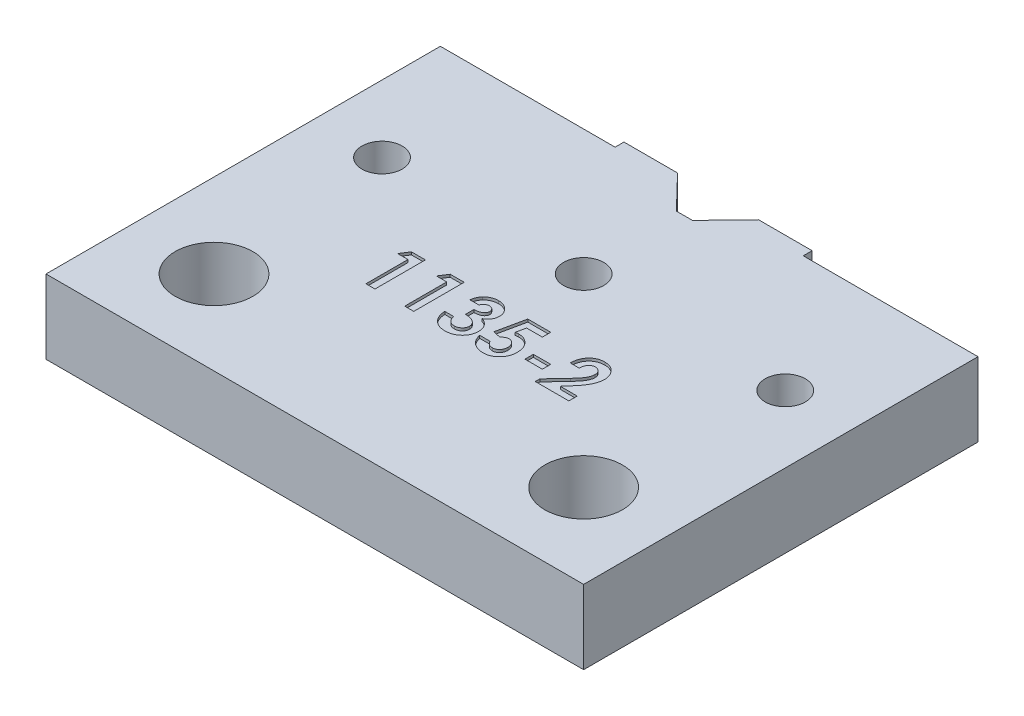
from build123d import *

# Parameters (mm, degrees)
CROQUIS1_W               = 50.8
CROQUIS1_H               = 38.1
SALIENTE_EXTRUIR1_DEPTH  = 6.985
CROQUIS2_W               = 16.51
CROQUIS2_H               = 0.8382
CORTAR_EXTRUIR1_DEPTH    = 64.883019849
TALADRO_ROSCADO_10_241_D = 3.7973
CROQUIS5_R               = 3.6703
CORTAR_EXTRUIR2_DEPTH    = 64.883019849
CROQUIS6_W               = 1.648557693
CROQUIS6_H               = 0.79375
CORTAR_EXTRUIR3_DEPTH    = 0.254


with BuildPart() as part:
    # Croquis1 → Saliente-Extruir1 (new body)
    with BuildSketch(Plane(origin=(0, 0, 0), x_dir=(1, 0, 0), z_dir=(0, 1, 0))):
        with Locations((25.4, -19.05)):
            Rectangle(CROQUIS1_W, CROQUIS1_H)
    extrude(amount=SALIENTE_EXTRUIR1_DEPTH)

    # Croquis2 → Cortar-Extruir1 (cut, through all)
    with BuildSketch(Plane(origin=(0, 6.985, 0), x_dir=(1, 0, 0), z_dir=(0, 1, 0))):
        Polygon((21.57193814, 0), (24.638, -3.175), (26.162, -3.175), (29.22806186, 0), align=None)
        with Locations((8.255, -0.4191)):
            Rectangle(CROQUIS2_W, CROQUIS2_H)
        with Locations((42.545, -0.4191)):
            Rectangle(CROQUIS2_W, CROQUIS2_H)
    extrude(amount=-CORTAR_EXTRUIR1_DEPTH, mode=Mode.SUBTRACT)

    # Taladro roscado #10-241 (through all)
    with Locations(Plane(origin=(0, 6.985, 0), x_dir=(1, 0, 0), z_dir=(0, 1, 0))):
        with Locations((6.35, -12.7), (44.45, -12.7), (25.4, -12.7)):
            Hole(TALADRO_ROSCADO_10_241_D / 2)

    # Croquis5 → Cortar-Extruir2 (cut, through all)
    with BuildSketch(Plane(origin=(0, 6.985, 0), x_dir=(1, 0, 0), z_dir=(0, 1, 0))):
        with Locations(Location((7.9375, -30.1625, 0), (0, 0, 270))):
            Circle(CROQUIS5_R)
        with Locations(Location((42.8625, -30.1625, 0), (0, 0, 270))):
            Circle(CROQUIS5_R)
    extrude(amount=-CORTAR_EXTRUIR2_DEPTH, mode=Mode.SUBTRACT)

    # Croquis6 → Cortar-Extruir3 (cut)
    with BuildSketch(Plane(origin=(0, 6.985, 0), x_dir=(1, 0, 0), z_dir=(0, 1, 0))):
        with BuildLine():
            Line((32.892109266, -20.612303363), (32.037301574, -20.612303363))
            add(Edge.make_bspline(
                [(32.037301574, -20.612303363), (32.040993357, -20.547641684), (32.04820688, -20.421296644), (32.076900451, -20.237776428), (32.115348852, -20.064370005), (32.166663346, -19.901683969), (32.231143367, -19.749777435), (32.307129675, -19.608132545), (32.39656355, -19.477495063), (32.497541543, -19.358494997), (32.608349327, -19.251738939), (32.726686423, -19.157082312), (32.854362957, -19.078974045), (32.989046173, -19.014698173), (33.130713138, -18.963344738), (33.280704244, -18.929010811), (33.437720786, -18.905759539), (33.545211325, -18.903724959), (33.599996886, -18.902687979)],
                knots=[0, 0, 0, 0, 1.199038563, 2.342849363, 3.436047546, 4.486744587, 5.497670872, 6.488682221, 7.459191391, 8.424610317, 9.374430501, 10.305433194, 11.225809216, 12.140057399, 13.06607119, 14.010487599, 14.985989317, 16, 16, 16, 16], degree=3))
            add(Edge.make_bspline(
                [(33.599996886, -18.902687979), (33.667245386, -18.904786309), (33.798530217, -18.908882742), (33.989297489, -18.943826674), (34.167453264, -19.002275799), (34.332868038, -19.083944641), (34.484133607, -19.187696345), (34.621224887, -19.311403271), (34.739996018, -19.457660856), (34.841200045, -19.62038356), (34.925288496, -19.792684003), (34.98421418, -19.970849806), (35.022945397, -20.150153171), (35.027076321, -20.270886981), (35.029128497, -20.330865563)],
                knots=[0, 0, 0, 0, 1.075374347, 2.099382735, 3.09057751, 4.06680945, 5.040638231, 6.016817125, 7.011024321, 8.044445721, 9.0776792, 10.070479129, 11.0414456, 12, 12, 12, 12], degree=3))
            add(Edge.make_bspline(
                [(35.029128497, -20.330865563), (35.028329488, -20.367144848), (35.026721281, -20.440166088), (35.015539202, -20.550665146), (34.998763874, -20.663221355), (34.973470768, -20.77773821), (34.94192819, -20.89424781), (34.903662485, -21.01309883), (34.857786041, -21.133617427), (34.805064443, -21.257160018), (34.742167443, -21.384127696), (34.668932629, -21.516423758), (34.583416183, -21.653930846), (34.486651037, -21.797425369), (34.378167224, -21.946681015), (34.257435163, -22.101248179), (34.125845404, -22.261671507), (34.03245245, -22.368905499), (33.984469543, -22.423999577)],
                knots=[0, 0, 0, 0, 0.728284026, 1.46585585, 2.227944881, 3.01186502, 3.81876927, 4.650621989, 5.517437689, 6.406905708, 7.346299482, 8.360816762, 9.441613733, 10.596154504, 11.834900912, 13.145207542, 14.533280747, 16, 16, 16, 16], degree=3))
            Line((33.984469543, -22.423999577), (33.487421766, -22.993553363))
            Line((33.487421766, -22.993553363), (35.090186189, -22.993553363))
            Line((35.090186189, -22.993553363), (35.090186189, -23.787303363))
            Line((35.090186189, -23.787303363), (31.915186189, -23.787303363))
            Line((31.915186189, -23.787303363), (31.915186189, -23.354175359))
            Line((31.915186189, -23.354175359), (33.325237271, -21.853491765))
            add(Edge.make_bspline(
                [(33.325237271, -21.853491765), (33.366061873, -21.809716358), (33.445127021, -21.724936378), (33.557628579, -21.600427957), (33.65943255, -21.482272438), (33.748427948, -21.369211702), (33.829285136, -21.26491298), (33.898398698, -21.166232578), (33.956400969, -21.074062602), (34.019370661, -20.962921709), (34.079171169, -20.830366416), (34.134041755, -20.677657284), (34.167489174, -20.531702523), (34.172105975, -20.436595263), (34.174320805, -20.390969229)],
                knots=[0, 0, 0, 0, 1.246127091, 2.413378631, 3.493388633, 4.492180848, 5.408488754, 6.240484944, 6.999099869, 7.674939598, 8.898438119, 10.020720584, 11.050475521, 12, 12, 12, 12], degree=3))
            add(Edge.make_bspline(
                [(34.174320805, -20.390969229), (34.17266483, -20.34682956), (34.169456114, -20.261301876), (34.134194927, -20.1396392), (34.079567073, -20.029486067), (34.002588712, -19.934133976), (33.909343807, -19.85577684), (33.80159056, -19.797497004), (33.680207478, -19.763869806), (33.595115625, -19.759660882), (33.551341538, -19.757495671)],
                knots=[0, 0, 0, 0, 1.062038974, 2.057870785, 3.028805853, 4.01125022, 4.991535629, 5.949134679, 6.94496649, 8, 8, 8, 8], degree=3))
            add(Edge.make_bspline(
                [(33.551341538, -19.757495671), (33.528727287, -19.758295526), (33.484207502, -19.759870169), (33.418766899, -19.770352139), (33.356495463, -19.788825517), (33.296700079, -19.813577243), (33.2400189, -19.846385834), (33.186594892, -19.886827649), (33.135865167, -19.933874971), (33.088062391, -19.987380688), (33.044555624, -20.047093083), (33.005913073, -20.112466807), (32.973962117, -20.18346128), (32.945831333, -20.259139266), (32.924135527, -20.340313609), (32.908338289, -20.426498489), (32.896328703, -20.517553694), (32.893541332, -20.580145586), (32.892109266, -20.612303363)],
                knots=[0, 0, 0, 0, 0.903469896, 1.778625579, 2.63899355, 3.493148037, 4.358286772, 5.247621495, 6.164656832, 7.118446693, 8.109501108, 9.111810964, 10.146451449, 11.215617525, 12.33435995, 13.498009769, 14.714554818, 16, 16, 16, 16], degree=3))
        make_face()
        with Locations((30.419272728, -22.047159133)):
            Rectangle(CROQUIS6_W, CROQUIS6_H)
        with BuildLine():
            Line((26.449568701, -19.024803363), (28.618070805, -19.024803363))
            Line((28.618070805, -19.024803363), (28.618070805, -19.818553363))
            Line((28.618070805, -19.818553363), (27.126927475, -19.818553363))
            Line((27.126927475, -19.818553363), (26.940892319, -20.719154325))
            add(Edge.make_bspline(
                [(26.940892319, -20.719154325), (26.966242272, -20.712094043), (27.016237588, -20.698169716), (27.091555593, -20.684205379), (27.164549237, -20.675154139), (27.21244722, -20.673946824), (27.23568649, -20.673361056)],
                knots=[0, 0, 0, 0, 1.05461699, 2.079921384, 3.068411212, 4, 4, 4, 4], degree=3))
            add(Edge.make_bspline(
                [(27.23568649, -20.673361056), (27.286327292, -20.67452146), (27.38615147, -20.676808874), (27.532181574, -20.698523886), (27.672014026, -20.732724372), (27.805220922, -20.781501321), (27.931672137, -20.844985781), (28.051520956, -20.921784181), (28.164914471, -21.012031407), (28.269838338, -21.115783962), (28.366246769, -21.229706617), (28.450068402, -21.352926022), (28.521657307, -21.483685189), (28.578596647, -21.622796914), (28.623538028, -21.769387482), (28.656013674, -21.923550832), (28.675218146, -22.085469672), (28.677807751, -22.195935319), (28.679128497, -22.252274818)],
                knots=[0, 0, 0, 0, 1.01440847, 1.999622559, 2.951875003, 3.895578053, 4.836219714, 5.782137149, 6.743708247, 7.735272588, 8.734977101, 9.730283169, 10.717124674, 11.717316708, 12.737475749, 13.78628267, 14.87096371, 16, 16, 16, 16], degree=3))
            add(Edge.make_bspline(
                [(28.679128497, -22.252274818), (28.677514524, -22.3092539), (28.674329684, -22.421690286), (28.65355152, -22.587011544), (28.616877687, -22.745351988), (28.566502508, -22.897135491), (28.500136435, -23.04124648), (28.420322149, -23.179177838), (28.325710205, -23.309905744), (28.217229072, -23.432090079), (28.09929585, -23.543768907), (27.973724808, -23.642012986), (27.84139812, -23.724684582), (27.702312593, -23.791497209), (27.557266205, -23.84435817), (27.406214933, -23.882838426), (27.248424688, -23.904904715), (27.141305612, -23.907897536), (27.086858365, -23.909418748)],
                knots=[0, 0, 0, 0, 1.06808661, 2.107647099, 3.116961351, 4.110378221, 5.100014249, 6.085620622, 7.093190682, 8.119403071, 9.144090782, 10.133780668, 11.103064255, 12.062861538, 13.020824475, 13.992378307, 14.979551724, 16, 16, 16, 16], degree=3))
            add(Edge.make_bspline(
                [(27.086858365, -23.909418748), (27.038167812, -23.908174302), (26.942139852, -23.905719993), (26.800694882, -23.890634519), (26.664326225, -23.86396326), (26.533757848, -23.825363042), (26.407615953, -23.777854986), (26.287358778, -23.718437184), (26.172325487, -23.64824103), (26.062842733, -23.568547607), (25.960689455, -23.478776056), (25.867454766, -23.380505627), (25.782574214, -23.27497497), (25.707864107, -23.160882157), (25.643558641, -23.038395754), (25.586531242, -22.908959292), (25.539853744, -22.771221042), (25.516166259, -22.675733233), (25.504128497, -22.62720721)],
                knots=[0, 0, 0, 0, 1.054957082, 2.080596141, 3.077793124, 4.061112343, 5.027190972, 5.994718051, 6.962465889, 7.943658696, 8.924948258, 9.904494768, 10.875059, 11.855380583, 12.854004648, 13.869083016, 14.917087635, 16, 16, 16, 16], degree=3))
            Line((25.504128497, -22.62720721), (26.481051574, -22.62720721))
            add(Edge.make_bspline(
                [(26.481051574, -22.62720721), (26.498909751, -22.660833768), (26.533615081, -22.726183147), (26.599632291, -22.812944266), (26.673534366, -22.886930422), (26.75465467, -22.948864474), (26.843518812, -22.995264411), (26.936505745, -23.030451978), (27.034783625, -23.050785569), (27.101715201, -23.053327469), (27.135513713, -23.054611056)],
                knots=[0, 0, 0, 0, 1.104910296, 2.147267069, 3.153527244, 4.136738762, 5.099945312, 6.05603338, 7.018353, 8, 8, 8, 8], degree=3))
            add(Edge.make_bspline(
                [(27.135513713, -23.054611056), (27.159070823, -23.053724728), (27.205419834, -23.051980864), (27.273707772, -23.042755383), (27.338891609, -23.025282533), (27.401455971, -23.001086696), (27.461568922, -22.970911756), (27.518368722, -22.932817859), (27.572843586, -22.888970371), (27.624164184, -22.838655231), (27.670645853, -22.782565553), (27.711405193, -22.722293371), (27.747849664, -22.659177945), (27.77484464, -22.590719114), (27.796951243, -22.518961084), (27.81323144, -22.443362563), (27.822960693, -22.363835256), (27.823861362, -22.309544193), (27.824320805, -22.281849637)],
                knots=[0, 0, 0, 0, 0.978869489, 1.925942215, 2.855067702, 3.774946051, 4.70828698, 5.642468714, 6.60995405, 7.609372294, 8.622401667, 9.629904756, 10.629323, 11.642352373, 12.678539694, 13.745912462, 14.850161547, 16, 16, 16, 16], degree=3))
            add(Edge.make_bspline(
                [(27.824320805, -22.281849637), (27.823787568, -22.254797936), (27.822749612, -22.202141141), (27.814163424, -22.124822106), (27.798802901, -22.051460334), (27.777874056, -21.98149393), (27.751082636, -21.915347763), (27.71834173, -21.852628099), (27.679511465, -21.793651963), (27.63438337, -21.739620052), (27.586259233, -21.690060446), (27.534558447, -21.64671601), (27.479746808, -21.610743137), (27.42352752, -21.579337773), (27.363656512, -21.556481633), (27.301480041, -21.540741453), (27.237063495, -21.529191942), (27.193126367, -21.528513366), (27.170812692, -21.528168748)],
                knots=[0, 0, 0, 0, 1.166249705, 2.270133367, 3.348514167, 4.393962215, 5.415026464, 6.420877785, 7.440098956, 8.453121383, 9.451844239, 10.415694839, 11.355045125, 12.27538808, 13.187007209, 14.108269027, 15.039275622, 16, 16, 16, 16], degree=3))
            add(Edge.make_bspline(
                [(27.170812692, -21.528168748), (27.146574854, -21.529088439), (27.097997029, -21.530931698), (27.025822539, -21.545929801), (26.954518273, -21.570202357), (26.883687705, -21.603690196), (26.814033952, -21.64751521), (26.743718817, -21.698916928), (26.675095898, -21.76163017), (26.631463538, -21.808339136), (26.608891117, -21.832503183)],
                knots=[0, 0, 0, 0, 0.88288272, 1.769486374, 2.674910571, 3.623812639, 4.617874466, 5.670434592, 6.794841017, 8, 8, 8, 8], degree=3))
            Line((26.608891117, -21.832503183), (25.88955518, -21.667456609))
            Line((25.88955518, -21.667456609), (26.449568701, -19.024803363))
        make_face()
        with BuildLine():
            Line((23.000763112, -20.184899517), (22.14595542, -20.184899517))
            add(Edge.make_bspline(
                [(22.14595542, -20.184899517), (22.151990687, -20.14217073), (22.163822429, -20.058403774), (22.192134205, -19.937130088), (22.225998145, -19.822093697), (22.268275543, -19.713658899), (22.317860053, -19.611632534), (22.374247456, -19.515664498), (22.438047321, -19.426166703), (22.486950593, -19.372252877), (22.511347547, -19.345356248)],
                knots=[0, 0, 0, 0, 1.111473889, 2.178970933, 3.205615836, 4.199322666, 5.174200091, 6.12565194, 7.064921805, 8, 8, 8, 8], degree=3))
            add(Edge.make_bspline(
                [(22.511347547, -19.345356248), (22.546536921, -19.309868096), (22.615891478, -19.239924677), (22.731791076, -19.150334883), (22.85327526, -19.072801009), (22.982780447, -19.011331593), (23.118291438, -18.961579222), (23.260885865, -18.928160442), (23.409981035, -18.905986786), (23.511719732, -18.903802604), (23.563638713, -18.902687979)],
                knots=[0, 0, 0, 0, 1.01925491, 2.00884431, 2.983262333, 3.955970413, 4.92937149, 5.924503185, 6.940838805, 8, 8, 8, 8], degree=3))
            add(Edge.make_bspline(
                [(23.563638713, -18.902687979), (23.609797359, -18.903777694), (23.700535955, -18.905919854), (23.833898859, -18.923115956), (23.961049228, -18.953276003), (24.083331078, -18.992709588), (24.198946041, -19.046365571), (24.310445851, -19.108648747), (24.4147152, -19.18504165), (24.511998059, -19.271357943), (24.601370918, -19.364717464), (24.678768206, -19.464511114), (24.745308044, -19.568073174), (24.800128069, -19.67626405), (24.842277218, -19.789266814), (24.871529978, -19.906428663), (24.89067662, -20.027491072), (24.892584125, -20.109775561), (24.893551574, -20.151508592)],
                knots=[0, 0, 0, 0, 1.091422571, 2.145516843, 3.172569842, 4.178562979, 5.178154469, 6.181868002, 7.194278174, 8.227918432, 9.254613415, 10.245994977, 11.209837596, 12.161663635, 13.10878368, 14.055455738, 15.013766427, 16, 16, 16, 16], degree=3))
            add(Edge.make_bspline(
                [(24.893551574, -20.151508592), (24.891566312, -20.203191475), (24.887657941, -20.304939183), (24.855586933, -20.453854512), (24.805387083, -20.596244142), (24.732868517, -20.730115828), (24.642201839, -20.855105245), (24.530956863, -20.967033623), (24.402302132, -21.067655846), (24.305719313, -21.121730242), (24.25626191, -21.14942025)],
                knots=[0, 0, 0, 0, 0.992805628, 1.954529043, 2.915727527, 3.886831945, 4.871318353, 5.87440735, 6.911542536, 8, 8, 8, 8], degree=3))
            add(Edge.make_bspline(
                [(24.25626191, -21.14942025), (24.290208713, -21.1605657), (24.356912657, -21.18246601), (24.451724292, -21.225598421), (24.541879324, -21.272734997), (24.625825315, -21.327495273), (24.704397209, -21.387664986), (24.777116022, -21.453758488), (24.844416232, -21.525631664), (24.905199192, -21.603679791), (24.959146443, -21.68665464), (25.007550439, -21.772639541), (25.047389626, -21.86293847), (25.081138377, -21.956520154), (25.106832755, -22.054225654), (25.124923893, -22.155676371), (25.135381015, -22.260640888), (25.136975904, -22.331754285), (25.137782343, -22.367712017)],
                knots=[0, 0, 0, 0, 1.059543567, 2.081955587, 3.086750234, 4.076226789, 5.052108497, 6.020845489, 6.989030705, 7.970690546, 8.952259656, 9.923888338, 10.895517021, 11.877585046, 12.873342345, 13.889638361, 14.932918083, 16, 16, 16, 16], degree=3))
            add(Edge.make_bspline(
                [(25.137782343, -22.367712017), (25.136147583, -22.420555285), (25.132924169, -22.524751447), (25.112431214, -22.67822173), (25.074277023, -22.82454201), (25.024083072, -22.965395923), (24.957129788, -23.098965095), (24.87833703, -23.228314756), (24.781484898, -23.348959097), (24.673850384, -23.464087641), (24.554315982, -23.568757358), (24.424721243, -23.659501293), (24.287915845, -23.737375734), (24.143034259, -23.800596424), (23.990126821, -23.849283586), (23.829534347, -23.884476911), (23.660582071, -23.906008769), (23.545258925, -23.908265976), (23.486362571, -23.909418748)],
                knots=[0, 0, 0, 0, 1.005138573, 1.981928558, 2.936866704, 3.876260664, 4.820238198, 5.773547, 6.751179199, 7.756627054, 8.768222608, 9.766606018, 10.760583154, 11.757261445, 12.767156078, 13.807575856, 14.880313354, 16, 16, 16, 16], degree=3))
            add(Edge.make_bspline(
                [(23.486362571, -23.909418748), (23.430647571, -23.908203345), (23.32170426, -23.905826786), (23.162351868, -23.885256458), (23.010902502, -23.85207485), (22.866969663, -23.805302622), (22.731110214, -23.744647036), (22.602092129, -23.672419842), (22.482489936, -23.584455145), (22.370971031, -23.484723836), (22.270009239, -23.372830971), (22.179773173, -23.251368491), (22.102252554, -23.119874524), (22.037129469, -22.978910869), (21.984913033, -22.828230231), (21.943724862, -22.668139029), (21.91495425, -22.498324492), (21.9061921, -22.381488479), (21.901724651, -22.321918748)],
                knots=[0, 0, 0, 0, 1.066544725, 2.085487077, 3.070979577, 4.031932826, 4.977951092, 5.916076795, 6.857635327, 7.814973522, 8.776389752, 9.738577119, 10.707772778, 11.69409279, 12.707140348, 13.757286496, 14.856535458, 16, 16, 16, 16], degree=3))
            Line((21.901724651, -22.321918748), (22.756532343, -22.321918748))
            add(Edge.make_bspline(
                [(22.756532343, -22.321918748), (22.76194917, -22.351871191), (22.772499862, -22.410211427), (22.793078339, -22.49467512), (22.819894965, -22.572640326), (22.850901657, -22.644799997), (22.884393552, -22.712101564), (22.92485977, -22.772059415), (22.96933516, -22.82630165), (23.033513472, -22.890785417), (23.12526079, -22.957039795), (23.249150063, -23.014618002), (23.386965148, -23.048365905), (23.483311637, -23.052483046), (23.533109867, -23.054611056)],
                knots=[0, 0, 0, 0, 0.928156231, 1.807827665, 2.648129825, 3.438902246, 4.202261636, 4.936546065, 5.639352463, 6.338805438, 7.70633318, 9.064371875, 10.482673459, 12, 12, 12, 12], degree=3))
            add(Edge.make_bspline(
                [(23.533109867, -23.054611056), (23.559534568, -23.054157916), (23.611294646, -23.053270317), (23.687322493, -23.043432466), (23.759749722, -23.027229519), (23.828711232, -23.005210315), (23.894646038, -22.977607865), (23.956294387, -22.942016159), (24.014912829, -22.900635719), (24.069864126, -22.854113119), (24.120640257, -22.803420138), (24.162888985, -22.747286275), (24.201501264, -22.690244237), (24.230059185, -22.628562134), (24.255082075, -22.56555912), (24.270397362, -22.498948385), (24.281961504, -22.430127242), (24.282633566, -22.383029074), (24.282974651, -22.359125779)],
                knots=[0, 0, 0, 0, 1.110435564, 2.175094844, 3.216326037, 4.226890168, 5.215276772, 6.21526065, 7.213097102, 8.228249917, 9.239874822, 10.221364777, 11.178138315, 12.128914389, 13.072518965, 14.022636769, 14.996447288, 16, 16, 16, 16], degree=3))
            add(Edge.make_bspline(
                [(24.282974651, -22.359125779), (24.282069134, -22.332983455), (24.280266456, -22.280940076), (24.265538396, -22.204993709), (24.242279675, -22.131939424), (24.209970472, -22.062100741), (24.166825131, -21.995735071), (24.11591411, -21.931510918), (24.053226462, -21.872771035), (23.984449718, -21.81470844), (23.904695713, -21.764095369), (23.81784858, -21.717386941), (23.721625841, -21.680221452), (23.618376379, -21.647025787), (23.506147135, -21.622780189), (23.38563501, -21.605175522), (23.257034408, -21.592071575), (23.168388342, -21.590191598), (23.122878497, -21.58922644)],
                knots=[0, 0, 0, 0, 0.809814727, 1.612155564, 2.388397, 3.182215007, 3.988903953, 4.837162975, 5.715530372, 6.646997145, 7.623086902, 8.637258368, 9.698941581, 10.815059213, 11.996518529, 13.252603015, 14.589518788, 16, 16, 16, 16], degree=3))
            Line((23.122878497, -21.58922644), (23.122878497, -20.79547644))
            add(Edge.make_bspline(
                [(23.122878497, -20.79547644), (23.17954096, -20.790650884), (23.285545209, -20.781623223), (23.432684789, -20.760511724), (23.556557349, -20.732292729), (23.660140167, -20.69824804), (23.746148702, -20.65452579), (23.821285283, -20.606258356), (23.885996461, -20.550202786), (23.940686087, -20.488030648), (23.984436086, -20.421263603), (24.015399787, -20.350939407), (24.035846597, -20.279233978), (24.037783931, -20.230189626), (24.038743881, -20.205888099)],
                knots=[0, 0, 0, 0, 1.70044513, 3.18119609, 4.440695891, 5.496282586, 6.431922213, 7.318171381, 8.16090191, 8.983045123, 9.787564368, 10.536848927, 11.275007137, 12, 12, 12, 12], degree=3))
            add(Edge.make_bspline(
                [(24.038743881, -20.205888099), (24.037087691, -20.174881989), (24.033855159, -20.114364627), (24.008749563, -20.027751534), (23.965169092, -19.95054314), (23.906735332, -19.882901913), (23.835531765, -19.826402891), (23.752068701, -19.785385565), (23.658157296, -19.761286054), (23.592085562, -19.758787747), (23.557914555, -19.757495671)],
                knots=[0, 0, 0, 0, 1.009664648, 1.970651636, 2.907870547, 3.878035693, 4.867062054, 5.849714035, 6.887914197, 8, 8, 8, 8], degree=3))
            add(Edge.make_bspline(
                [(23.557914555, -19.757495671), (23.526942378, -19.759020184), (23.465484095, -19.762045286), (23.375613689, -19.784623841), (23.290266745, -19.822632029), (23.211210557, -19.87504308), (23.139586318, -19.937986531), (23.080803482, -20.012529983), (23.031910706, -20.09420741), (23.011186346, -20.154550302), (23.000763112, -20.184899517)],
                knots=[0, 0, 0, 0, 0.98818071, 1.960853194, 2.938124878, 3.957524365, 4.978590984, 5.968022688, 6.978025184, 8, 8, 8, 8], degree=3))
        make_face()
        Polygon((19.115013413, -19.024803363), (20.436340035, -19.024803363), (20.436340035, -23.787303363), (19.581532343, -23.787303363), (19.581532343, -19.818553363), (18.604609266, -19.818553363), align=None)
        Polygon((15.451551874, -19.024803363), (16.772878497, -19.024803363), (16.772878497, -23.787303363), (15.918070805, -23.787303363), (15.918070805, -19.818553363), (14.941147728, -19.818553363), align=None)
    extrude(amount=-CORTAR_EXTRUIR3_DEPTH, mode=Mode.SUBTRACT)


solid = part.part
